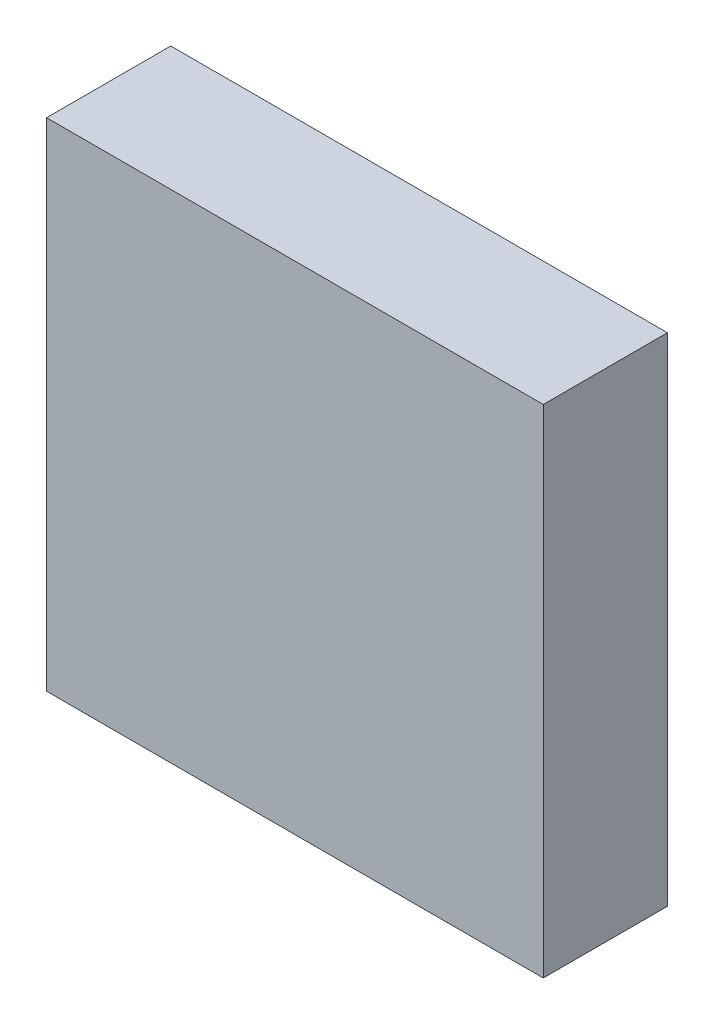
from build123d import *

# Parameters (mm, degrees)
ESBO_O1_W                = 200
ESBO_O1_H                = 200
RESSALTO_EXTRUS_O1_DEPTH = 50
CORTE_EXTRUS_O1_DEPTH    = 7


with BuildPart() as part:
    # Esboço1 → Ressalto-extrusão1 (new body)
    with BuildSketch(Plane.XY):
        with Locations((100, 100)):
            Rectangle(ESBO_O1_W, ESBO_O1_H)
    extrude(amount=RESSALTO_EXTRUS_O1_DEPTH)

    # Esboço3 → Corte-extrusão1 (cut)
    with BuildSketch(Plane(origin=(0, 0, 0), x_dir=(-1, 0, 0), z_dir=(0, 0, -1))):
        Polygon((-160.5, 176.55), (-160.5, 177.05), (-160.5, 178.95), (-179.5, 178.95), (-179.5, 177.05), (-179.5, 176.55), (-179.5, 174.65), (-160.5, 174.65), align=None)
        Polygon((-39.5, 177.05), (-39.5, 178.95), (-20.5, 178.95), (-20.5, 177.05), (-20.5, 176.55), (-20.5, 174.65), (-39.5, 174.65), (-39.5, 176.55), align=None)
        Polygon((-39.5, 23.45), (-39.5, 22.95), (-39.5, 21.05), (-20.5, 21.05), (-20.5, 22.95), (-20.5, 23.45), (-20.5, 25.35), (-39.5, 25.35), align=None)
        Polygon((-160.5, 22.95), (-160.5, 21.05), (-179.5, 21.05), (-179.5, 22.95), (-179.5, 23.45), (-179.5, 25.35), (-160.5, 25.35), (-160.5, 23.45), align=None)
    extrude(amount=-CORTE_EXTRUS_O1_DEPTH, mode=Mode.SUBTRACT)


solid = part.part
